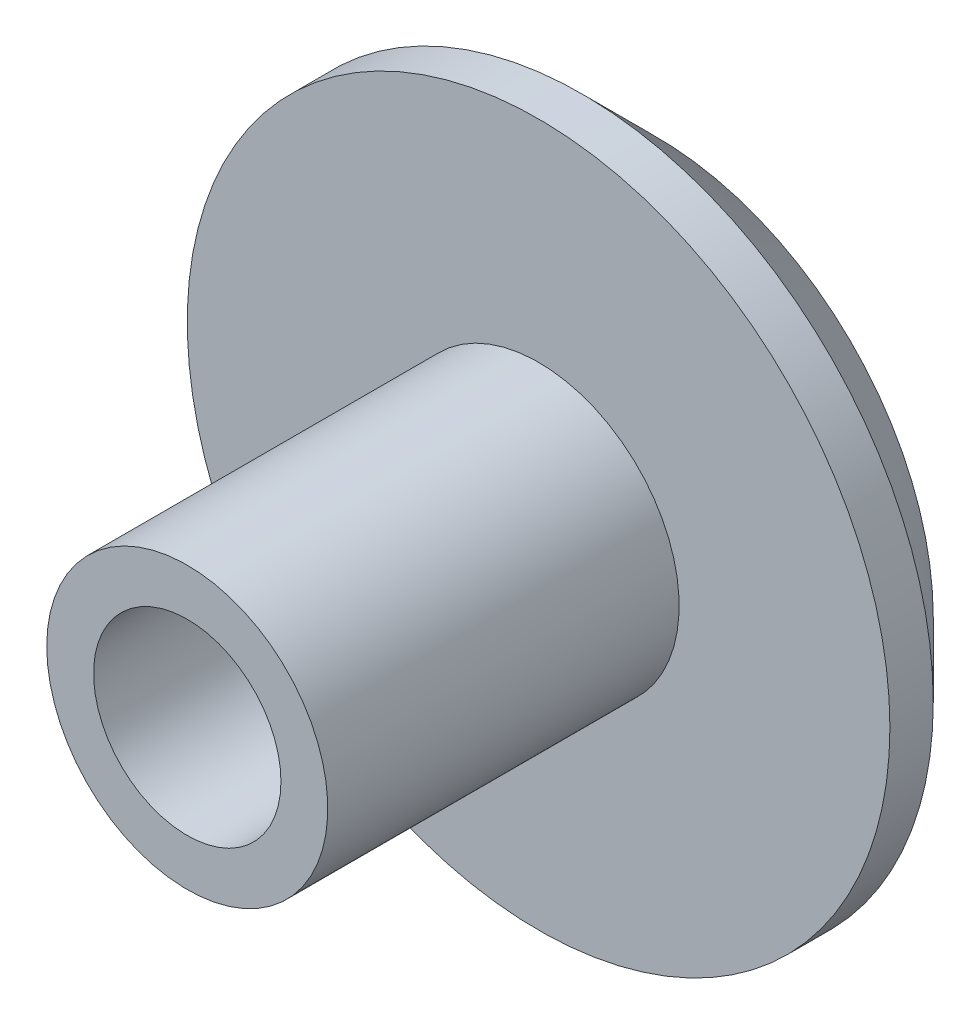
from build123d import *

# Parameters (mm, degrees)
SKETCH1_R           = 4.7625
BOSS_EXTRUDE1_DEPTH = 1.5875
SKETCH3_R           = 1.905
BOSS_EXTRUDE2_DEPTH = 4.7625
SKETCH4_R           = 1.27
CUT_EXTRUDE1_DEPTH  = 10.256636133
CHAMFER2_SIZE       = 1


with BuildPart() as part:
    # Sketch1 → Boss-Extrude1 (new body)
    with BuildSketch(Plane.XY):
        Circle(SKETCH1_R)
    extrude(amount=BOSS_EXTRUDE1_DEPTH)

    # Sketch3 → Boss-Extrude2 (add)
    with BuildSketch(Plane.XY.offset(1.5875)):
        with Locations(Location((0, 0, 0), (0, 0, 180))):
            Circle(SKETCH3_R)
    extrude(amount=BOSS_EXTRUDE2_DEPTH)

    # Sketch4 → Cut-Extrude1 (cut, through all)
    with BuildSketch(Plane.XY.offset(6.35)):
        Circle(SKETCH4_R)
    extrude(amount=-CUT_EXTRUDE1_DEPTH, mode=Mode.SUBTRACT)

    # Chamfer2
    chamfer2_edges = [part.edges().sort_by_distance(p)[0] for p in [
        (-4.7625, 0, 0),
    ]]
    chamfer(chamfer2_edges, length=CHAMFER2_SIZE)


solid = part.part
